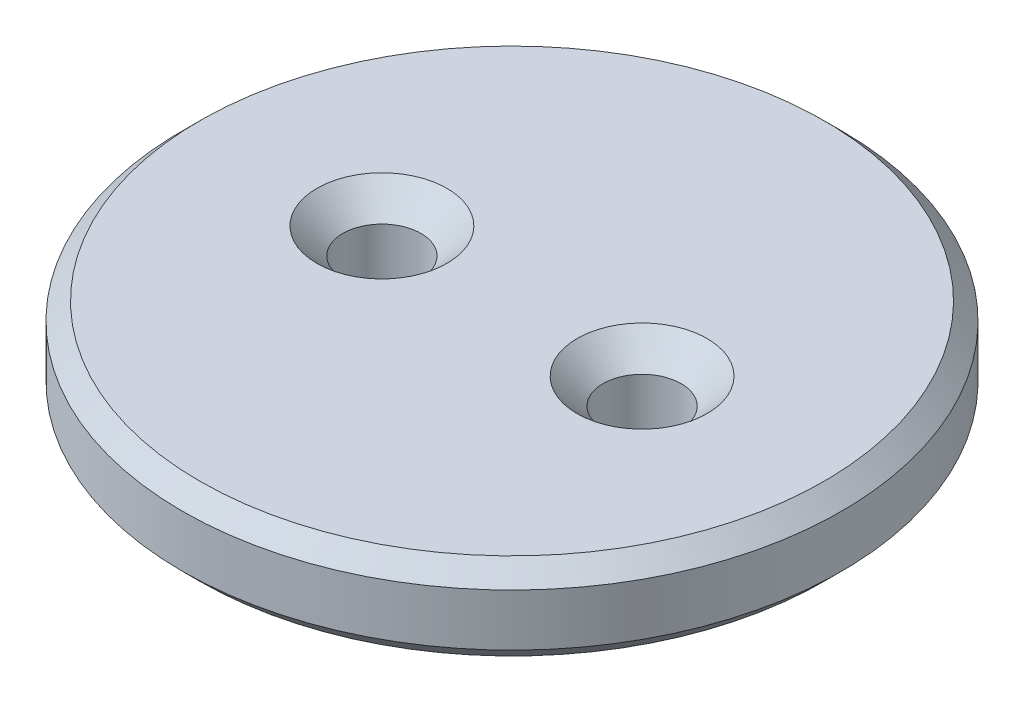
from build123d import *

# Parameters (mm, degrees)
SKETCH1_R           = 19
BOSS_EXTRUDE1_DEPTH = 5
CHAMFER2_SIZE       = 1
SKETCH2_R           = 2.25
CUT_EXTRUDE1_DEPTH  = 28.331300737
CHAMFER1_SIZE       = 1.5
SKETCH3_W           = 25
SKETCH3_H           = 13
BOSS_EXTRUDE2_DEPTH = 2
SKETCH4_R           = 2.25
CUT_EXTRUDE2_DEPTH  = 28.331300737


with BuildPart() as part:
    # Sketch1 → Boss-Extrude1 (new body)
    with BuildSketch(Plane(origin=(0, 0, 0), x_dir=(1, 0, 0), z_dir=(0, 1, 0))):
        with Locations(Location((0, 0, 0), (0, 0, 270))):
            Circle(SKETCH1_R)
    extrude(amount=BOSS_EXTRUDE1_DEPTH)

    # Chamfer2
    chamfer2_edges = [part.edges().sort_by_distance(p)[0] for p in [
        (0, 0, -19),
        (0, 5, -19),
    ]]
    chamfer(chamfer2_edges, length=CHAMFER2_SIZE)

    # Sketch2 → Cut-Extrude1 (cut, through all)
    with BuildSketch(Plane(origin=(0, 5, 0), x_dir=(1, 0, 0), z_dir=(0, 1, 0))):
        with Locations(Location((-7.5, 0, 0), (0, 0, 270))):
            Circle(SKETCH2_R)
        with Locations(Location((7.5, 0, 0), (0, 0, 90))):
            Circle(SKETCH2_R)
    extrude(amount=-CUT_EXTRUDE1_DEPTH, mode=Mode.SUBTRACT)

    # Chamfer1
    chamfer1_edges = [part.edges().sort_by_distance(p)[0] for p in [
        (-7.5, 5, -2.25),
        (7.5, 5, 2.25),
    ]]
    chamfer(chamfer1_edges, length=CHAMFER1_SIZE)

    # Sketch3 → Boss-Extrude2 (add)
    with BuildSketch(Plane.XZ):
        Rectangle(SKETCH3_W, SKETCH3_H)
    extrude(amount=BOSS_EXTRUDE2_DEPTH)

    # Sketch4 → Cut-Extrude2 (cut, through all)
    with BuildSketch(Plane(origin=(0, 0, 0), x_dir=(1, 0, 0), z_dir=(0, 1, 0))):
        with Locations(Location((7.5, 0, 0), (0, 0, 270))):
            Circle(SKETCH4_R)
        with Locations(Location((-7.5, 0, 0), (0, 0, 270))):
            Circle(SKETCH4_R)
    extrude(amount=-CUT_EXTRUDE2_DEPTH, mode=Mode.SUBTRACT)


solid = part.part
